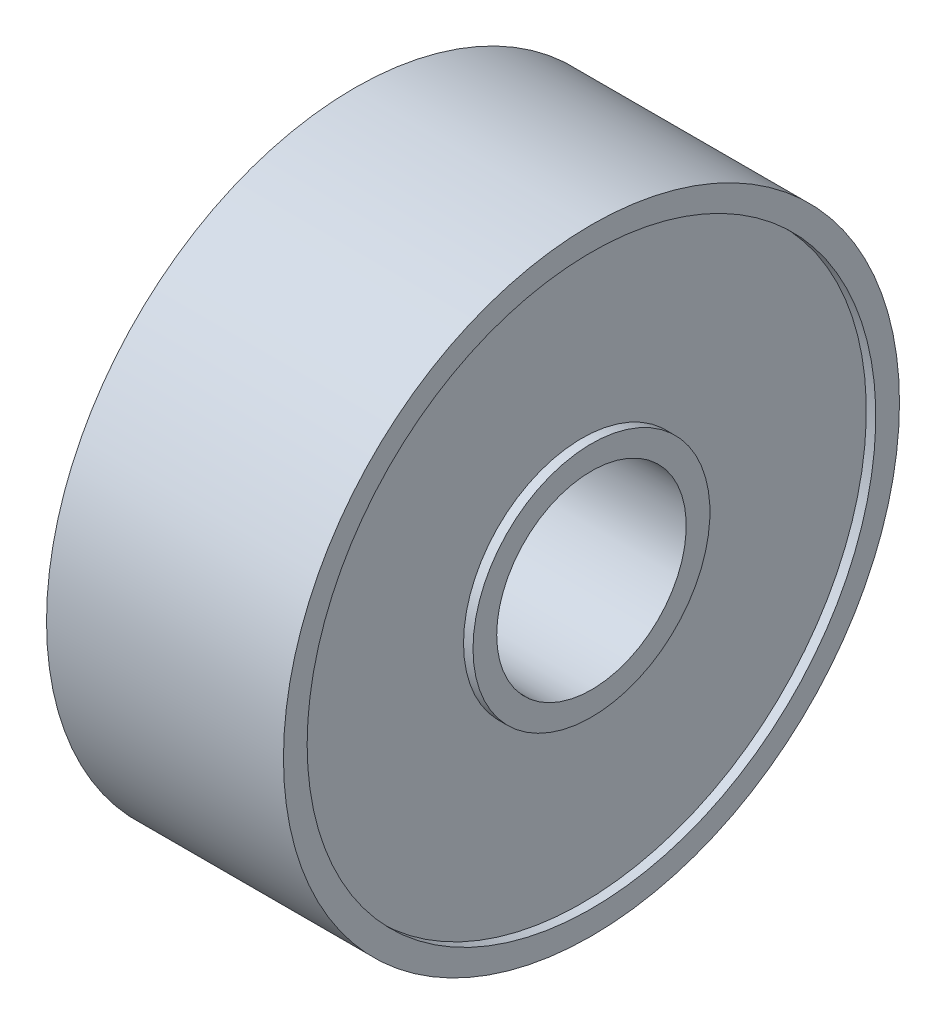
from build123d import *


with BuildPart() as part:
    # Esquisse1 → Révolution1 (revolve)
    with BuildSketch(Plane.XY, mode=Mode.PRIVATE) as r_volution1_sk:
        Polygon((-2.5, 2.5), (-2.3, 2.5), (-2.3, 6), (-2.5, 6), (-2.5, 6.5), (2.5, 6.5), (2.5, 6), (2.3, 6), (2.3, 2.5), (2.5, 2.5), (2.5, 2), (-2.5, 2), align=None)
    revolve(r_volution1_sk.sketch.rotate(Axis((-2.5, 0, 0), (1, 0, 0)), 90), axis=Axis((-2.5, 0, 0), (1, 0, 0)))


solid = part.part
